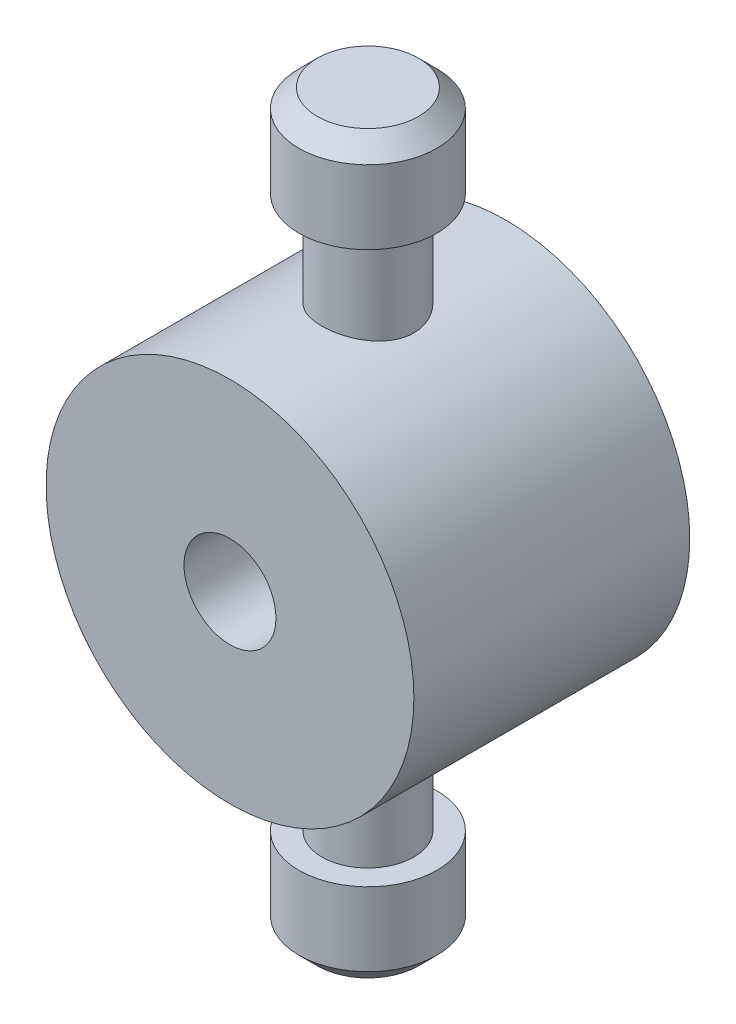
from build123d import *

# Parameters (mm, degrees)
SKETCH1_R                = 20
BOSS_EXTRUDE1_DEPTH      = 30
BOSS_EXTRUDE2_DEPTH      = 30
BOSS_EXTRUDE2_DEPTH_BACK = 30
SKETCH2_R                = 5
SKETCH3_R                = 7.5
BOSS_EXTRUDE3_DEPTH      = 10
CHAMFER1_SIZE            = 2
CHAMFER1_OF_MIRROR1_SIZE = 2
SKETCH4_R                = 5
CUT_EXTRUDE1_DEPTH       = 10


with BuildPart() as part:
    # Sketch1 → Boss-Extrude1 (new body)
    with BuildSketch(Plane.XY):
        Circle(SKETCH1_R)
    extrude(amount=BOSS_EXTRUDE1_DEPTH)

    # Sketch2 → Boss-Extrude2 (add, two sides: drawn at the far end of the back side and taken through both)
    with BuildSketch(Plane(origin=(0, 0, 0), x_dir=(1, 0, 0), z_dir=(0, 1, 0)).offset(-BOSS_EXTRUDE2_DEPTH_BACK)):
        with Locations((0, -15)):
            Circle(SKETCH2_R)
    extrude(amount=BOSS_EXTRUDE2_DEPTH + BOSS_EXTRUDE2_DEPTH_BACK)

    # Sketch3 → Boss-Extrude3 (add)
    with BuildSketch(Plane(origin=(0, 30, 0), x_dir=(1, 0, 0), z_dir=(0, 1, 0))):
        with Locations((0, -15)):
            Circle(SKETCH3_R)
    boss_extrude3 = extrude(amount=BOSS_EXTRUDE3_DEPTH)

    # Chamfer1
    chamfer1_edges = [part.edges().sort_by_distance(p)[0] for p in [
        (-7.5, 40, 15),
    ]]
    chamfer(chamfer1_edges, length=CHAMFER1_SIZE)

    # Mirror1: Boss-Extrude3 across plane
    add(boss_extrude3.mirror(Plane.ZX))

    # Chamfer1 of Mirror1
    chamfer1_of_mirror1_edges = [part.edges().sort_by_distance(p)[0] for p in [
        (-7.5, -40, 15),
    ]]
    chamfer(chamfer1_of_mirror1_edges, length=CHAMFER1_OF_MIRROR1_SIZE)

    # Sketch4 → Cut-Extrude1 (cut)
    with BuildSketch(Plane.XY.offset(30)):
        Circle(SKETCH4_R)
    extrude(amount=-CUT_EXTRUDE1_DEPTH, mode=Mode.SUBTRACT)


solid = part.part
